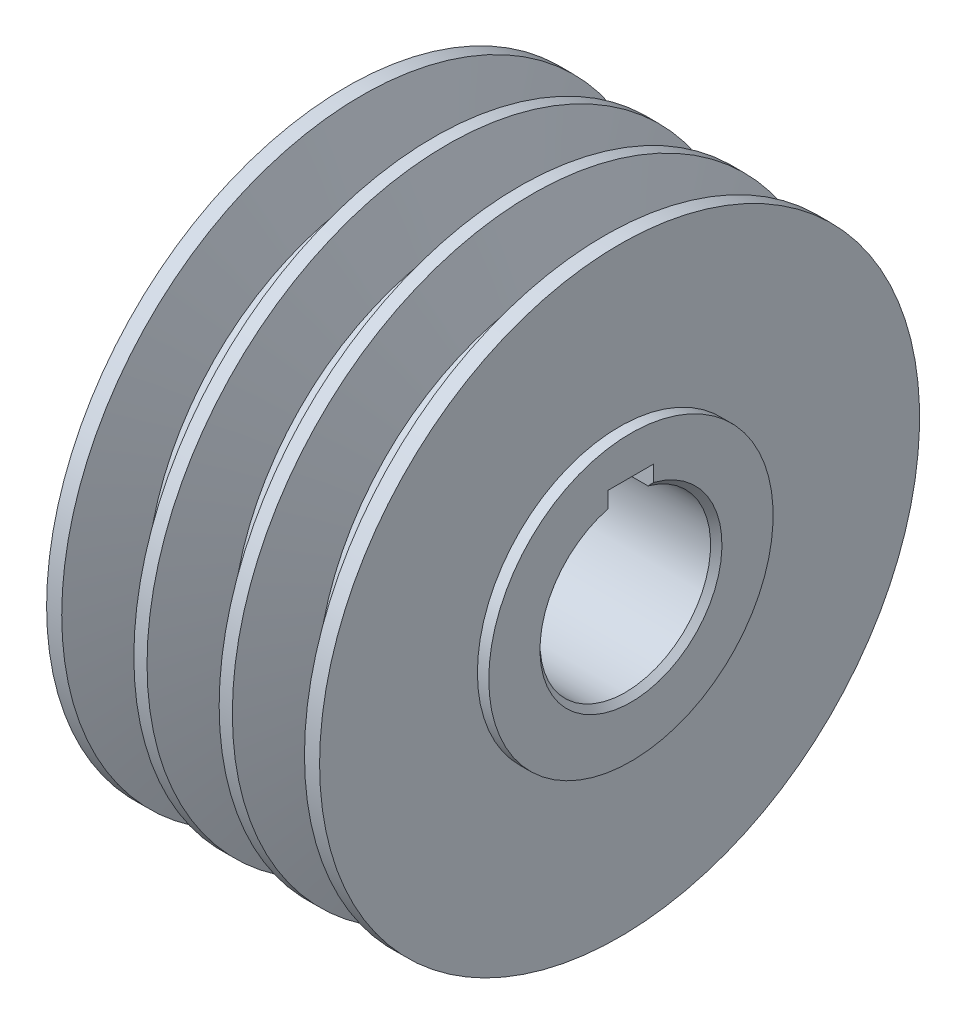
from build123d import *

# Parameters (mm, degrees)
PATTERN_LINEAR_1_COUNT = 3
PATTERN_LINEAR_1_PITCH = 15
CHAMFER_1_SIZE         = 1
SKETCH_4_W             = 8
SKETCH_4_H             = 3.843167705
CUT_EXTRUDE_1_DEPTH    = 90.806040999


with BuildPart() as part:
    # 草图1 → 旋转1 (revolve)
    with BuildSketch(Plane.XY, mode=Mode.PRIVATE) as revolve_1_sk:
        Polygon((0, 15), (0, 52.75), (48, 52.75), (48, 25), (50, 25), (50, 15), align=None)
    revolve(revolve_1_sk.sketch.rotate(Axis((0, 0, 0), (1, 0, 0)), 90), axis=Axis((0, 0, 0), (1, 0, 0)))

    # 草图2 → 切除-旋转1 (revolve, cut)
    with BuildSketch(Plane.XY, mode=Mode.PRIVATE) as cut_revolve_1_sk:
        Polygon((11.840143071, 41.3), (15.340759374, 52.75), (2.659240626, 52.75), (6.159856929, 41.3), align=None)
    cut_revolve_1 = revolve(cut_revolve_1_sk.sketch.rotate(Axis((0, 0, 0), (1, 0, 0)), 90), axis=Axis((0, 0, 0), (1, 0, 0)), mode=Mode.SUBTRACT)

    # 阵列(线性)1: 切除-旋转1 ×3
    with Locations(*[(i * PATTERN_LINEAR_1_PITCH, 0, 0) for i in range(1, PATTERN_LINEAR_1_COUNT)]):
        add(cut_revolve_1, mode=Mode.SUBTRACT)

    # 倒角1
    chamfer_1_edges = [part.edges().sort_by_distance(p)[0] for p in [
        (50, 0, -15),
        (0, 0, -15),
    ]]
    chamfer(chamfer_1_edges, length=CHAMFER_1_SIZE)

    # 草图4 → 切除-拉伸1 (cut, through all)
    with BuildSketch(Plane.ZY):
        with Locations((0, 16.378416148)):
            Rectangle(SKETCH_4_W, SKETCH_4_H)
    extrude(amount=-CUT_EXTRUDE_1_DEPTH, mode=Mode.SUBTRACT)


solid = part.part
